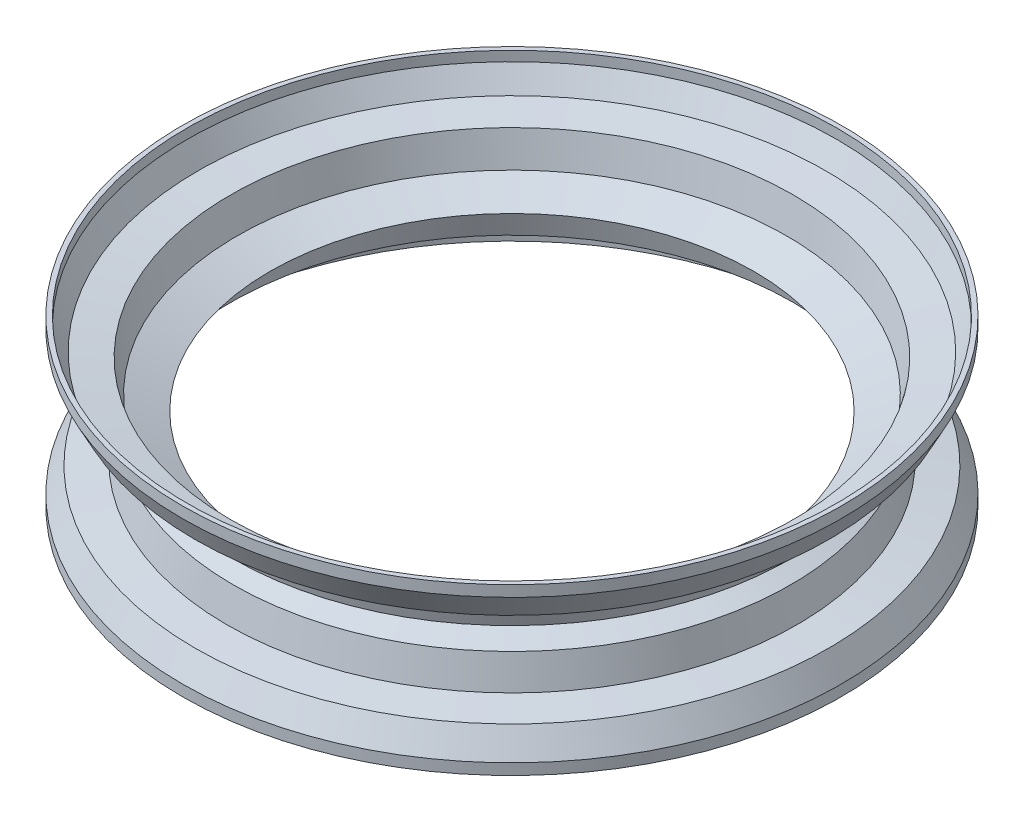
from build123d import *

# Parameters (mm, degrees)
SKETCH_1_R      = 35.893803705
EXTRUDE_1_DEPTH = 1.2
SHELL_1_T       = -0.5


with BuildPart() as part:
    # 스케치1 → 보스-돌출1 (new body)
    with BuildSketch(Plane(origin=(0, 0, 0), x_dir=(1, 0, 0), z_dir=(0, 1, 0))):
        with Locations(Location((0, 0, 0), (0, 0, 270))):
            Circle(SKETCH_1_R)
    extrude_1 = extrude(amount=EXTRUDE_1_DEPTH)

    # 스케치4 → 회전1 (revolve)
    with BuildSketch(Plane(origin=(0, 0, 0), x_dir=(0, 0, -1), z_dir=(1, 0, 0))):
        Polygon((-35.893803705, 1.2), (-34.502134468, 3.878923444), (-31.056679578, 4.371076556), (-30.349605559, 7.778923444), (-27.588745887, 9), (0, 9), (0, 1.2), align=None)
    revolve_1 = revolve(axis=Axis((0, 9, 0), (0, -1, 0)))

    # 대칭 복사1: 보스-돌출1, 회전1 across plane
    add(extrude_1.mirror(Plane(origin=(0, 9, 27.588745887), x_dir=(0, 0, 1), z_dir=(0, 1, 0))))
    add(revolve_1.mirror(Plane(origin=(0, 9, 27.588745887), x_dir=(0, 0, 1), z_dir=(0, 1, 0))))

    # 쉘1
    shell_1_openings = [part.faces().sort_by_distance(p)[0] for p in [
        (0, 18, 0),
        (0, 0, 0),
    ]]
    offset(amount=SHELL_1_T, openings=shell_1_openings, kind=Kind.INTERSECTION)


solid = part.part
